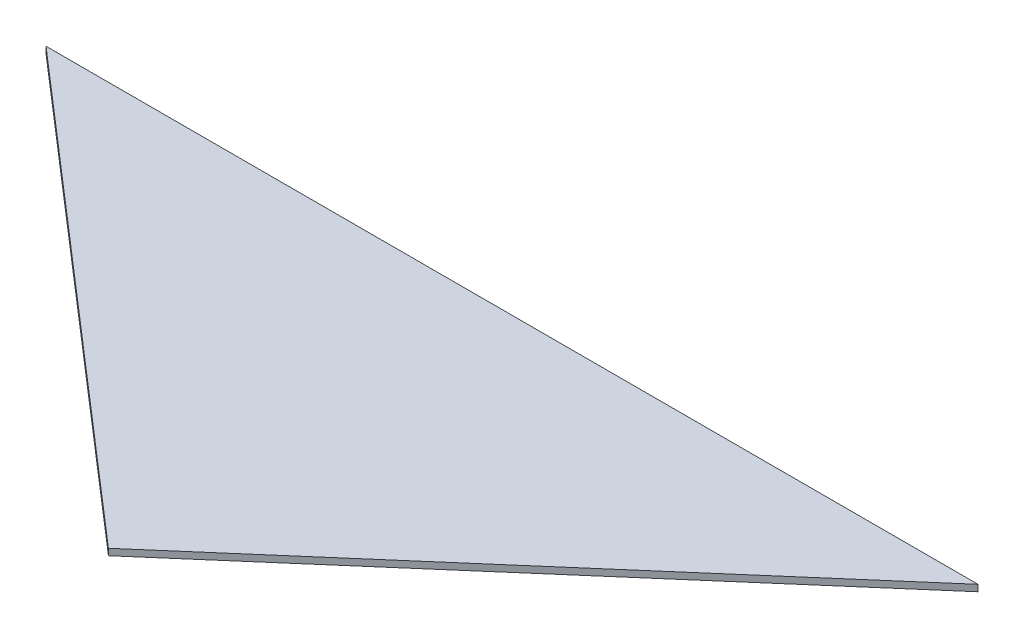
from build123d import *

# Parameters (mm, degrees)
BOSS_EXTRUDE2_DEPTH = 6.35


with BuildPart() as part:
    # Sketch1 → Boss-Extrude2 (new body)
    with BuildSketch(Plane(origin=(0, 0, 0), x_dir=(1, 0, 0), z_dir=(0, 1, 0))):
        Polygon((0, 0), (-457.2, 0), (0, -395.94681461), align=None)
        Polygon((457.2, 0), (0, 0), (0, -395.94681461), align=None)
    extrude(amount=BOSS_EXTRUDE2_DEPTH)


solid = part.part
